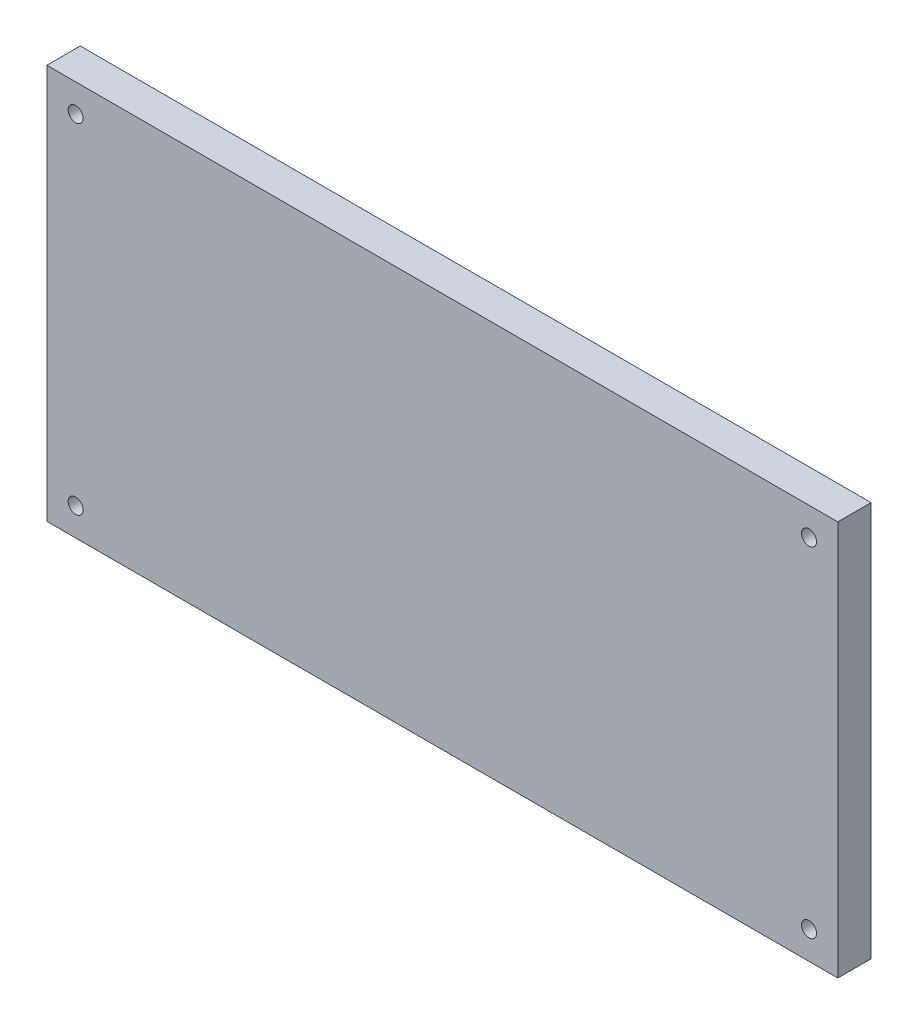
from build123d import *

# Parameters (mm, degrees)
ESQUISSE1_W        = 94.9
ESQUISSE1_H        = 47.4
ESQUISSE1_R        = 0.9
BOSS_EXTRU_1_DEPTH = 4


with BuildPart() as part:
    # Esquisse1 → Boss.-Extru.1 (new body)
    with BuildSketch(Plane.XY):
        with Locations((47.45, 23.7)):
            Rectangle(ESQUISSE1_W, ESQUISSE1_H)
        with Locations((3.45, 44.05)):
            Circle(ESQUISSE1_R, mode=Mode.SUBTRACT)
        with Locations((3.45, 3.35)):
            Circle(ESQUISSE1_R, mode=Mode.SUBTRACT)
        with Locations((91.45, 3.35)):
            Circle(ESQUISSE1_R, mode=Mode.SUBTRACT)
        with Locations((91.45, 44.05)):
            Circle(ESQUISSE1_R, mode=Mode.SUBTRACT)
    extrude(amount=BOSS_EXTRU_1_DEPTH)


solid = part.part
